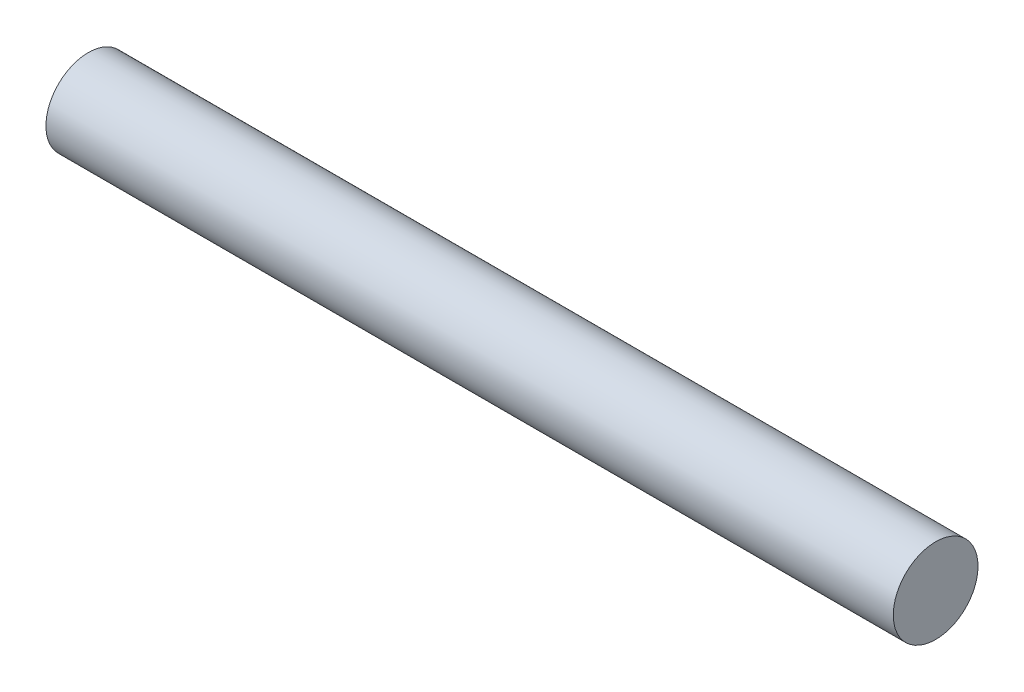
from build123d import *

# Parameters (mm, degrees)
SKETCH1_R           = 1.5875
BOSS_EXTRUDE1_DEPTH = 31.75


with BuildPart() as part:
    # Sketch1 → Boss-Extrude1 (new body)
    with BuildSketch(Plane(origin=(0, 0, 0), x_dir=(0, 0, -1), z_dir=(1, 0, 0))):
        Circle(SKETCH1_R)
    extrude(amount=BOSS_EXTRUDE1_DEPTH)


solid = part.part
